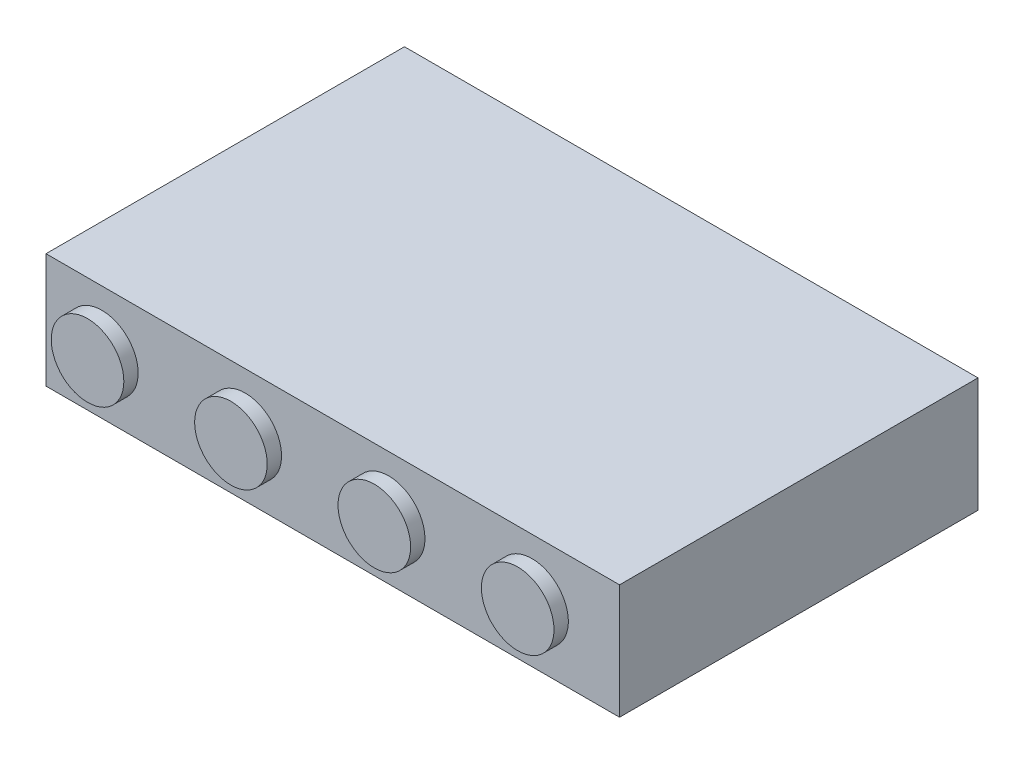
from build123d import *

# Parameters (mm, degrees)
SKETCH_1_W      = 400
SKETCH_1_H      = 250
EXTRUDE_1_DEPTH = 80
SKETCH_3_R      = 26.348031195
EXTRUDE_2_DEPTH = 10
SKETCH_2_R      = 25.309072204
EXTRUDE_3_DEPTH = 10


with BuildPart() as part:
    # 草图1 → 凸台-拉伸1 (new body)
    with BuildSketch(Plane(origin=(0, 0, 0), x_dir=(1, 0, 0), z_dir=(0, 1, 0))):
        with Locations((10.638297872, -13.031914894)):
            Rectangle(SKETCH_1_W, SKETCH_1_H)
    extrude(amount=EXTRUDE_1_DEPTH)

    # 草图3 → 凸台-拉伸2 (add)
    with BuildSketch(Plane(origin=(0, 0, -111.968085106), x_dir=(-1, 0, 0), z_dir=(0, 0, -1))):
        with Locations(Location((-10.638297872, 40, 0), (0, 0, 180))):
            Circle(SKETCH_3_R)
    extrude(amount=EXTRUDE_2_DEPTH)

    # 草图2 → 凸台-拉伸3 (add)
    with BuildSketch(Plane.XY.offset(138.031914894)):
        with Locations(Location((-150.390563376, 40, 0), (0, 0, 180))):
            Circle(SKETCH_2_R)
        with Locations(Location((-50.390563376, 40, 0), (0, 0, 180))):
            Circle(SKETCH_2_R)
        with Locations(Location((49.609436624, 40, 0), (0, 0, 180))):
            Circle(SKETCH_2_R)
        with Locations(Location((149.609436624, 40, 0), (0, 0, 180))):
            Circle(SKETCH_2_R)
    extrude(amount=EXTRUDE_3_DEPTH)


solid = part.part
